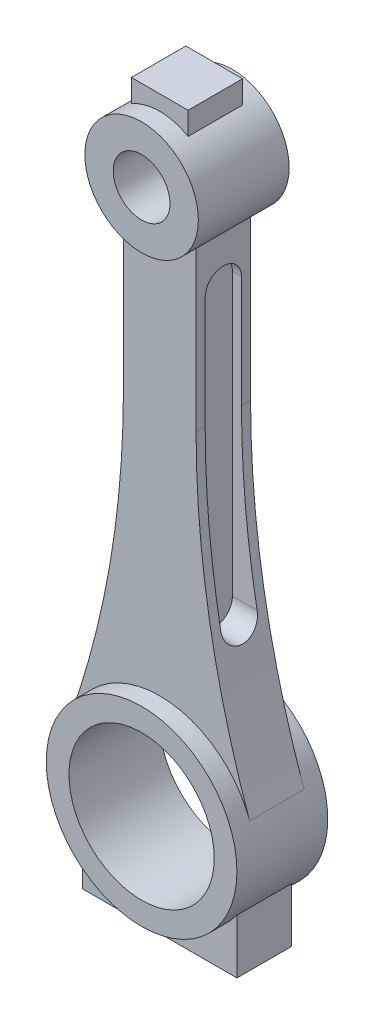
from build123d import *

# Parameters (mm, degrees)
SKETCH1_R             = 21
SKETCH1_R_2           = 16
BOSS_EXTRUDE3_DEPTH   = 10
SKETCH1_R_3           = 12.5
SKETCH1_R_4           = 6.25
BOSS_EXTRUDE3_2_DEPTH = 10
BOSS_EXTRUDE4_DEPTH   = 6
BOSS_EXTRUDE5_DEPTH   = 6
CUT_EXTRUDE1_START    = 6
CUT_EXTRUDE1_DEPTH    = 132.802456026
CUT_EXTRUDE2_START    = -6
CUT_EXTRUDE2_DEPTH    = 132.802456026


with BuildPart() as part:
    # Sketch1 → Boss-Extrude3 (new, symmetric)
    with BuildSketch(Plane.XY):
        Circle(SKETCH1_R)
        Circle(SKETCH1_R_2, mode=Mode.SUBTRACT)
    extrude(amount=BOSS_EXTRUDE3_DEPTH, both=True)



with BuildPart() as body_2:
    # Sketch1 → Boss-Extrude3 2 (new, symmetric)
    with BuildSketch(Plane.XY):
        with Locations((0, 120)):
            Circle(SKETCH1_R_3)
        with Locations((0, 120)):
            Circle(SKETCH1_R_4, mode=Mode.SUBTRACT)
    extrude(amount=BOSS_EXTRUDE3_2_DEPTH, both=True)


with BuildPart() as part_1:
    add(part.part)

    add(body_2.part)  # Boss-Extrude4 merges body 2
    # Sketch1<8> → Boss-Extrude4 (add, symmetric)
    with BuildSketch(Plane.XY):
        with BuildLine():
            ThreePointArc((8, 110.395313644), (0, 107.5), (-8, 110.395313644))
            Line((-8, 110.395313644), (-8, 75.395313644))
            ThreePointArc((-8, 75.395313644), (-10.96842855, 40.709642053), (-19.787382488, 7.032744434))
            ThreePointArc((-19.787382488, 7.032744434), (0, 21), (19.787382488, 7.032744434))
            ThreePointArc((19.787382488, 7.032744434), (10.96842855, 40.709642053), (8, 75.395313644))
            Line((8, 75.395313644), (8, 110.395313644))
        make_face()
        with BuildLine():
            ThreePointArc((17, -12.328828006), (0, -21), (-17, -12.328828006))
            Line((-17, -12.328828006), (-17, -24.328828006))
            Line((-17, -24.328828006), (17, -24.328828006))
            Line((17, -24.328828006), (17, -12.328828006))
        make_face()
    extrude(amount=BOSS_EXTRUDE4_DEPTH, both=True)

    # Sketch1<9> → Boss-Extrude5 (add, symmetric)
    with BuildSketch(Plane.XY):
        with BuildLine():
            Line((-6.25, 135.825317547), (-6.25, 130.825317547))
            ThreePointArc((-6.25, 130.825317547), (0, 132.5), (6.25, 130.825317547))
            Line((6.25, 130.825317547), (6.25, 135.825317547))
            Line((6.25, 135.825317547), (-6.25, 135.825317547))
        make_face()
    extrude(amount=BOSS_EXTRUDE5_DEPTH, both=True)

    # Sketch2 → Cut-Extrude1 (cut, through all)
    with BuildSketch(Plane(origin=(0, 0, 0), x_dir=(0, 0, -1), z_dir=(1, 0, 0)).offset(CUT_EXTRUDE1_START)):
        with BuildLine():
            Line((4, 100), (4, 38))
            ThreePointArc((4, 38), (0, 34), (-4, 38))
            Line((-4, 38), (-4, 100))
            ThreePointArc((-4, 100), (0, 104), (4, 100))
        make_face()
    extrude(amount=CUT_EXTRUDE1_DEPTH, mode=Mode.SUBTRACT)

    # Sketch2<2> → Cut-Extrude2 (cut, through all)
    with BuildSketch(Plane(origin=(0, 0, 0), x_dir=(0, 0, -1), z_dir=(1, 0, 0)).offset(CUT_EXTRUDE2_START)):
        with BuildLine():
            Line((4, 100), (4, 38))
            ThreePointArc((4, 38), (0, 34), (-4, 38))
            Line((-4, 38), (-4, 100))
            ThreePointArc((-4, 100), (0, 104), (4, 100))
        make_face()
    extrude(amount=-CUT_EXTRUDE2_DEPTH, mode=Mode.SUBTRACT)


solid = part_1.part
